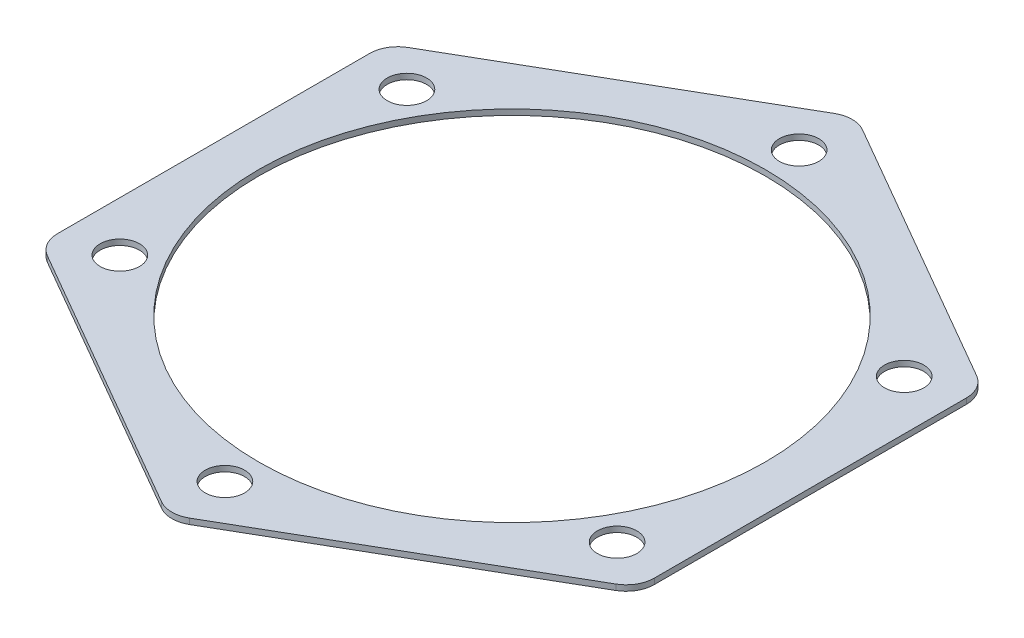
from build123d import *

# Parameters (mm, degrees)
SKETCH1_R           = 45
SKETCH1_R_2         = 3.5
BOSS_EXTRUDE1_DEPTH = 1


with BuildPart() as part:
    # Sketch1 → Boss-Extrude1 (new body)
    with BuildSketch(Plane(origin=(0, 0, 0), x_dir=(1, 0, 0), z_dir=(0, 1, 0))):
        with BuildLine():
            Line((-2.5, 59.755752861), (-50.5, 32.04293994))
            ThreePointArc((-50.5, 32.04293994), (-52.330127019, 30.212812921), (-53, 27.712812921))
            Line((-53, 27.712812921), (-53, -27.712812921))
            ThreePointArc((-53, -27.712812921), (-52.330127019, -30.212812921), (-50.5, -32.04293994))
            Line((-50.5, -32.04293994), (-2.5, -59.755752861))
            ThreePointArc((-2.5, -59.755752861), (0, -60.425625842), (2.5, -59.755752861))
            Line((2.5, -59.755752861), (50.5, -32.04293994))
            ThreePointArc((50.5, -32.04293994), (52.330127019, -30.212812921), (53, -27.712812921))
            Line((53, -27.712812921), (53, 27.712812921))
            ThreePointArc((53, 27.712812921), (52.330127019, 30.212812921), (50.5, 32.04293994))
            Line((50.5, 32.04293994), (2.5, 59.755752861))
            ThreePointArc((2.5, 59.755752861), (0, 60.425625842), (-2.5, 59.755752861))
        make_face()
        with Locations(Location((0, 0, 0), (0, 0, 270))):
            Circle(SKETCH1_R, mode=Mode.SUBTRACT)
        with Locations(Location((0, 51, 0), (0, 0, 270))):
            Circle(SKETCH1_R_2, mode=Mode.SUBTRACT)
        with Locations(Location((44.167295593, 25.5, 0), (0, 0, 270))):
            Circle(SKETCH1_R_2, mode=Mode.SUBTRACT)
        with Locations(Location((44.167295593, -25.5, 0), (0, 0, 270))):
            Circle(SKETCH1_R_2, mode=Mode.SUBTRACT)
        with Locations(Location((0, -51, 0), (0, 0, 270))):
            Circle(SKETCH1_R_2, mode=Mode.SUBTRACT)
        with Locations(Location((-44.167295593, -25.5, 0), (0, 0, 270))):
            Circle(SKETCH1_R_2, mode=Mode.SUBTRACT)
        with Locations(Location((-44.167295593, 25.5, 0), (0, 0, 270))):
            Circle(SKETCH1_R_2, mode=Mode.SUBTRACT)
    extrude(amount=BOSS_EXTRUDE1_DEPTH)


solid = part.part
